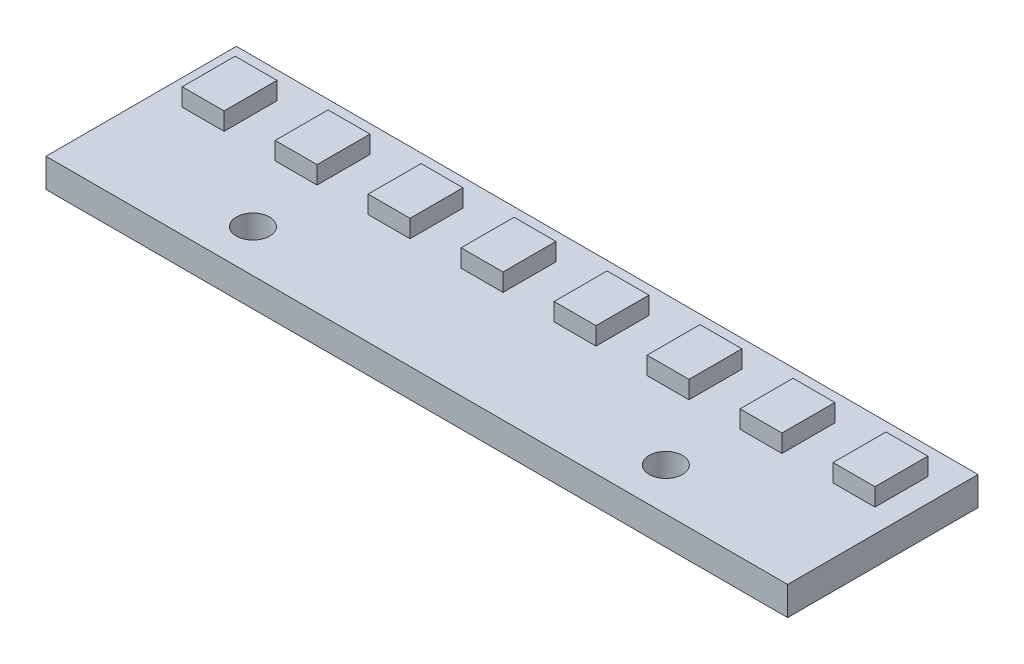
from build123d import *

# Parameters (mm, degrees)
SKETCH1_W           = 67
SKETCH1_H           = 17.2
BOSS_EXTRUDE1_DEPTH = 2.6
SKETCH2_R           = 1.5
CUT_EXTRUDE1_DEPTH  = 2.6
SKETCH3_W           = 3.782264846
SKETCH3_H           = 4.781353673
BOSS_EXTRUDE2_DEPTH = 1.6


with BuildPart() as part:
    # Sketch1 → Boss-Extrude1 (new body)
    with BuildSketch(Plane(origin=(0, 0, 0), x_dir=(1, 0, 0), z_dir=(0, 1, 0))):
        Rectangle(SKETCH1_W, SKETCH1_H)
    extrude(amount=BOSS_EXTRUDE1_DEPTH)

    # Sketch2 → Cut-Extrude1 (cut)
    with BuildSketch(Plane(origin=(0, 2.6, 0), x_dir=(1, 0, 0), z_dir=(0, 1, 0))):
        with Locations(Location((-18.65, -4.75, 0), (0, 0, 270))):
            Circle(SKETCH2_R)
        with Locations(Location((18.65, -4.75, 0), (0, 0, 270))):
            Circle(SKETCH2_R)
    extrude(amount=-CUT_EXTRUDE1_DEPTH, mode=Mode.SUBTRACT)

    # Sketch3 → Boss-Extrude2 (add)
    with BuildSketch(Plane(origin=(0, 2.6, 0), x_dir=(1, 0, 0), z_dir=(0, 1, 0))):
        with Locations((-20.894711683, 3.782264846)):
            Rectangle(SKETCH3_W, SKETCH3_H)
        with Locations((-29.294711683, 3.782264846)):
            Rectangle(SKETCH3_W, SKETCH3_H)
        with Locations((-12.494711683, 3.782264846)):
            Rectangle(SKETCH3_W, SKETCH3_H)
        with Locations((-4.094711683, 3.782264846)):
            Rectangle(SKETCH3_W, SKETCH3_H)
        with Locations((4.305288317, 3.782264846)):
            Rectangle(SKETCH3_W, SKETCH3_H)
        with Locations((12.705288317, 3.782264846)):
            Rectangle(SKETCH3_W, SKETCH3_H)
        with Locations((21.105288317, 3.782264846)):
            Rectangle(SKETCH3_W, SKETCH3_H)
        with Locations((29.505288317, 3.782264846)):
            Rectangle(SKETCH3_W, SKETCH3_H)
    extrude(amount=BOSS_EXTRUDE2_DEPTH)


solid = part.part
